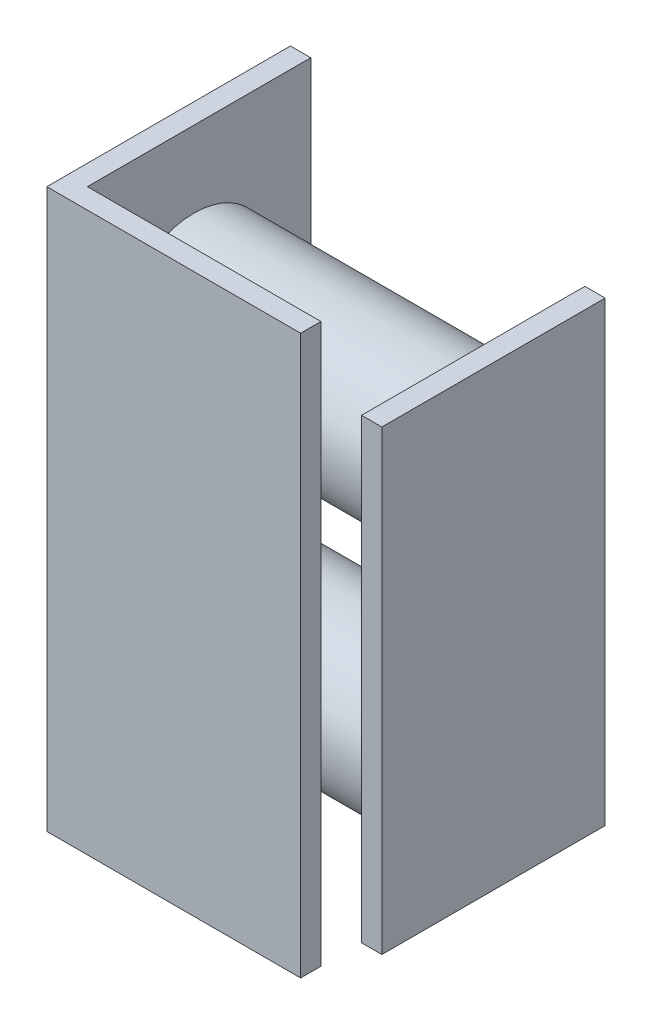
from build123d import *

# Parameters (mm, degrees)
BOSS_EXTRUDE1_DEPTH      = 55
BOSS_EXTRUDE2_DEPTH      = 1
BOSS_EXTRUDE2_DEPTH_BACK = 30
SKETCH2_R                = 7.5
SKETCH4_W                = 22
SKETCH4_H                = 45
BOSS_EXTRUDE3_DEPTH      = 2


with BuildPart() as part:
    # Sketch1 → Boss-Extrude1 (new body)
    with BuildSketch(Plane(origin=(0, 0, 0), x_dir=(1, 0, 0), z_dir=(0, 1, 0))):
        Polygon((0, 0), (25, 0), (25, 2), (2, 2), (2, 24), (0, 24), align=None)
    extrude(amount=BOSS_EXTRUDE1_DEPTH)

    # Sketch2 → Boss-Extrude2 (add, two sides: drawn at the far end of the back side and taken through both)
    with BuildSketch(Plane.ZY.offset(-BOSS_EXTRUDE2_DEPTH_BACK)):
        with Locations((-12.5, 15)):
            Circle(SKETCH2_R)
        with Locations((-12.5, 40)):
            Circle(SKETCH2_R)
    extrude(amount=BOSS_EXTRUDE2_DEPTH + BOSS_EXTRUDE2_DEPTH_BACK)


with BuildPart() as body_2:
    # Sketch4 → Boss-Extrude3 (new body)
    with BuildSketch(Plane(origin=(30, 0, 0), x_dir=(0, 0, -1), z_dir=(1, 0, 0))):
        with Locations((12, 27.5)):
            Rectangle(SKETCH4_W, SKETCH4_H)
    extrude(amount=BOSS_EXTRUDE3_DEPTH)


solid = Compound([part.part, body_2.part])
